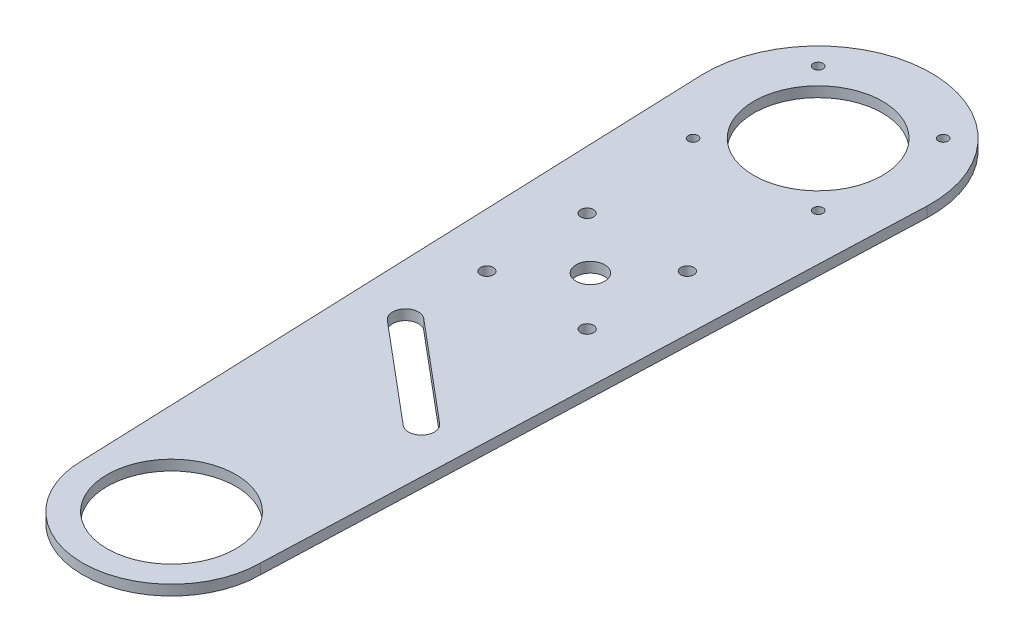
from build123d import *

# Parameters (mm, degrees)
BOSS_EXTRUDE1_DEPTH     = 3.175
SKETCH2_R               = 19.9
CUT_EXTRUDE1_DEPTH      = 140.49939292
ESQUISSE2_R             = 1.5
ENL_V_MAT_EXTRU_1_DEPTH = 140.49939292
SKETCH3_R               = 4.425
CUT_EXTRUDE2_DEPTH      = 140.49939292
CUT_EXTRUDE4_DEPTH      = 140.49939292
SKETCH6_R               = 2
CUT_EXTRUDE5_DEPTH      = 140.49939292


with BuildPart() as part:
    # Sketch1 → Boss-Extrude1 (new body)
    with BuildSketch(Plane(origin=(0, 0, 0), x_dir=(1, 0, 0), z_dir=(0, 1, 0))):
        with BuildLine():
            Line((-27.5, -100), (-34.975254116, 98.684097441))
            ThreePointArc((-34.975254116, 98.684097441), (0, 135), (34.975254116, 98.684097441))
            Line((34.975254116, 98.684097441), (27.5, -100))
            ThreePointArc((27.5, -100), (0, -127.5), (-27.5, -100))
        make_face()
    extrude(amount=BOSS_EXTRUDE1_DEPTH)

    # Sketch2 → Cut-Extrude1 (cut, through all)
    with BuildSketch(Plane(origin=(0, 3.175, 0), x_dir=(1, 0, 0), z_dir=(0, 1, 0))):
        with Locations(Location((0, -100, 0), (0, 0, 270))):
            Circle(SKETCH2_R)
        with Locations(Location((0, 100, 0), (0, 0, 270))):
            Circle(SKETCH2_R)
    extrude(amount=-CUT_EXTRUDE1_DEPTH, mode=Mode.SUBTRACT)

    # Esquisse2 → Enlèv. mat.-Extru.1 (cut, through all)
    with BuildSketch(Plane(origin=(0, 3.175, 0), x_dir=(1, 0, 0), z_dir=(0, 1, 0))):
        with Locations(Location((19.339370465, 80.660629535, 0), (0, 0, 270))):
            Circle(ESQUISSE2_R)
        with Locations(Location((19.339370465, 119.339370465, 0), (0, 0, 270))):
            Circle(ESQUISSE2_R)
        with Locations(Location((-19.339370465, 119.339370465, 0), (0, 0, 270))):
            Circle(ESQUISSE2_R)
        with Locations(Location((-19.339370465, 80.660629535, 0), (0, 0, 270))):
            Circle(ESQUISSE2_R)
    extrude(amount=-ENL_V_MAT_EXTRU_1_DEPTH, mode=Mode.SUBTRACT)

    # Sketch3 → Cut-Extrude2 (cut, through all)
    with BuildSketch(Plane(origin=(0, 3.175, 0), x_dir=(1, 0, 0), z_dir=(0, 1, 0))):
        with Locations(Location((0.85, 28.7, 0), (0, 0, 270))):
            Circle(SKETCH3_R)
    extrude(amount=-CUT_EXTRUDE2_DEPTH, mode=Mode.SUBTRACT)

    # Sketch5 → Cut-Extrude4 (cut, through all)
    with BuildSketch(Plane(origin=(0, 3.175, 0), x_dir=(1, 0, 0), z_dir=(0, 1, 0))):
        with BuildLine():
            Line((12.749738424, -41.07568216), (-17.892039301, -15.364177772))
            ThreePointArc((-17.892039301, -15.364177772), (-18.385066635, -9.728849561), (-12.749738424, -9.235822228))
            Line((-12.749738424, -9.235822228), (17.892039301, -34.947326615))
            ThreePointArc((17.892039301, -34.947326615), (18.385066635, -40.582654826), (12.749738424, -41.07568216))
        make_face()
    extrude(amount=-CUT_EXTRUDE4_DEPTH, mode=Mode.SUBTRACT)

    # Sketch6 → Cut-Extrude5 (cut, through all)
    with BuildSketch(Plane(origin=(0, 0, 0), x_dir=(-1, 0, 0), z_dir=(0, -1, 0))):
        with Locations(Location((-15.35, 13.2, 0), (0, 0, 90))):
            Circle(SKETCH6_R)
        with Locations(Location((-15.35, 44.2, 0), (0, 0, 90))):
            Circle(SKETCH6_R)
        with Locations(Location((15.65, 44.2, 0), (0, 0, 90))):
            Circle(SKETCH6_R)
        with Locations(Location((15.65, 13.2, 0), (0, 0, 90))):
            Circle(SKETCH6_R)
    extrude(amount=-CUT_EXTRUDE5_DEPTH, mode=Mode.SUBTRACT)


solid = part.part
